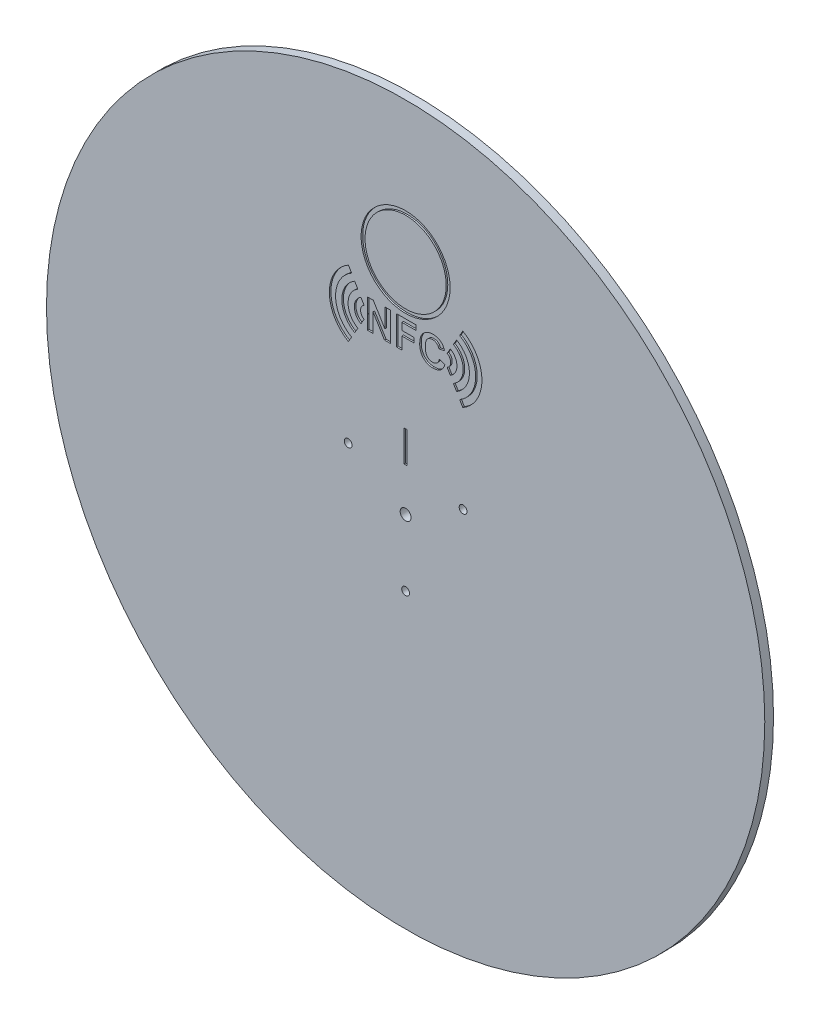
from build123d import *

# Parameters (mm, degrees)
SKETCH1_R           = 115
SKETCH1_R_2         = 12.6
SKETCH1_R_3         = 1.75
BOSS_EXTRUDE1_DEPTH = 1.2
SKETCH2_R           = 115
SKETCH2_R_2         = 1.75
BOSS_EXTRUDE2_DEPTH = 0.8
SKETCH3_R           = 14.25
SKETCH3_R_2         = 13
CUT_EXTRUDE1_DEPTH  = 0.5
BOSS_EXTRUDE3_START = 0.8
SKETCH4_R           = 115
SKETCH4_R_2         = 1.75
BOSS_EXTRUDE3_DEPTH = 0.8
SKETCH5_R           = 1.25
SKETCH5_W           = 1
SKETCH5_H           = 10
CUT_EXTRUDE2_DEPTH  = 2.8
SKETCH6_W           = 1
SKETCH6_H           = 10
BOSS_EXTRUDE4_DEPTH = 2.3


with BuildPart() as part:
    # Sketch1 → Boss-Extrude1 (new body)
    with BuildSketch(Plane.XY):
        Circle(SKETCH1_R)
        with Locations((0, 70)):
            Circle(SKETCH1_R_2, mode=Mode.SUBTRACT)
        Circle(SKETCH1_R_3, mode=Mode.SUBTRACT)
    extrude(amount=BOSS_EXTRUDE1_DEPTH)

    # Sketch2 → Boss-Extrude2 (add)
    with BuildSketch(Plane.XY.offset(1.2)):
        Circle(SKETCH2_R)
        Circle(SKETCH2_R_2, mode=Mode.SUBTRACT)
    extrude(amount=BOSS_EXTRUDE2_DEPTH)

    # Sketch3 → Cut-Extrude1 (cut)
    # profile 1 of 10: a face of its own
    with BuildSketch(Plane.XY.offset(2)):
        with BuildLine():
            Line((-14.304598289, 45.736382), (-13.304598289, 47.468432807))
            ThreePointArc((-13.304598289, 47.468432807), (-14.429598289, 49.416989966), (-13.304598289, 51.365547124))
            Line((-13.304598289, 51.365547124), (-14.304598289, 53.097597932))
            ThreePointArc((-14.304598289, 53.097597932), (-16.429598289, 49.416989966), (-14.304598289, 45.736382))
        make_face()
    # profile 2 of 10: a face of its own
    with BuildSketch(Plane.XY.offset(2)):
        Polygon((-12.179598289, 49.416989966), (-12.209391902, 49.365385915), (-12.209391902, 45), (-10.43132512, 45), (-10.43132512, 50.98245386), (-6.7751753, 45), (-4.860049204, 45), (-4.860049204, 54.245947266), (-6.638115986, 54.245947266), (-6.638115986, 48.167181455), (-10.351682546, 54.245947266), (-12.209391902, 54.245947266), (-12.209391902, 49.468594016), align=None)
    # profile 3 of 10: a face of its own
    with BuildSketch(Plane.XY.offset(2)):
        with BuildLine():
            Line((-16.304598289, 42.272280384), (-15.304598289, 44.004331192))
            ThreePointArc((-15.304598289, 44.004331192), (-18.429598289, 49.416989966), (-15.304598289, 54.829648739))
            Line((-15.304598289, 54.829648739), (-16.304598289, 56.561699547))
            ThreePointArc((-16.304598289, 56.561699547), (-20.429598289, 49.416989966), (-16.304598289, 42.272280384))
        make_face()
    # profile 4 of 10: a face of its own
    with BuildSketch(Plane.XY.offset(2)):
        with BuildLine():
            Line((-18.304598289, 38.808178769), (-17.304598289, 40.540229577))
            ThreePointArc((-17.304598289, 40.540229577), (-22.429598289, 49.416989966), (-17.304598289, 58.293750354))
            Line((-17.304598289, 58.293750354), (-18.304598289, 60.025801162))
            ThreePointArc((-18.304598289, 60.025801162), (-24.429598289, 49.416989966), (-18.304598289, 38.808178769))
        make_face()
    # profile 5 of 10: a face of its own
    with BuildSketch(Plane.XY.offset(2)):
        with BuildLine():
            ThreePointArc((13.304598289, 51.365547124), (14.429598289, 49.416989966), (13.304598289, 47.468432807))
            Line((13.304598289, 47.468432807), (14.304598289, 45.736382))
            ThreePointArc((14.304598289, 45.736382), (16.429598289, 49.416989966), (14.304598289, 53.097597932))
            Line((14.304598289, 53.097597932), (13.304598289, 51.365547124))
        make_face()
    # profile 6 of 10: a face of its own
    with BuildSketch(Plane.XY.offset(2)):
        with BuildLine():
            ThreePointArc((15.304598289, 54.829648739), (18.429598289, 49.416989966), (15.304598289, 44.004331192))
            Line((15.304598289, 44.004331192), (16.304598289, 42.272280384))
            ThreePointArc((16.304598289, 42.272280384), (20.429598289, 49.416989966), (16.304598289, 56.561699547))
            Line((16.304598289, 56.561699547), (15.304598289, 54.829648739))
        make_face()
    # profile 7 of 10: a face of its own
    with BuildSketch(Plane.XY.offset(2)):
        with BuildLine():
            ThreePointArc((17.304598289, 58.293750354), (22.429598289, 49.416989966), (17.304598289, 40.540229577))
            Line((17.304598289, 40.540229577), (18.304598289, 38.808178769))
            ThreePointArc((18.304598289, 38.808178769), (24.429598289, 49.416989966), (18.304598289, 60.025801162))
            Line((18.304598289, 60.025801162), (17.304598289, 58.293750354))
        make_face()
    # profile 8 of 10: a face of its own
    with BuildSketch(Plane.XY.offset(2)):
        Polygon((-2.963444636, 54.245947266), (-2.963444636, 45), (-1.185377855, 45), (-1.185377855, 48.91174692), (2.726369066, 48.91174692), (2.726369066, 50.452738131), (-1.185377855, 50.452738131), (-1.185377855, 52.704956055), (3.319057993, 52.704956055), (3.319057993, 54.245947266), align=None)
    # profile 9 of 10: a face of its own
    with BuildSketch(Plane.XY.offset(2)):
        with BuildLine():
            Line((12.565005258, 47.844906851), (10.786938477, 48.437595778))
            add(Edge.make_bspline(
                [(8.649554033, 46.540991211), (8.774457906, 46.542804078), (8.960902987, 46.552124821), (9.200761468, 46.603342992), (9.371697205, 46.653314203), (9.536735909, 46.716051803), (9.693353441, 46.796521205), (9.844632955, 46.889011376), (9.987435142, 46.997402051), (10.123671935, 47.119091548), (10.24792915, 47.259733892), (10.363183369, 47.415951417), (10.467995906, 47.588781763), (10.565774579, 47.776770817), (10.680063587, 48.058750047), (10.75051939, 48.282015418), (10.786938477, 48.437595778)],
                knots=[0, 0, 0, 0, 0.12046088, 0.178740623, 0.235724111, 0.291792154, 0.348405626, 0.404978529, 0.462271107, 0.520759571, 0.580529381, 0.642578218, 0.707405436, 0.774920301, 0.846330275, 1, 1, 1, 1], degree=3))
            add(Edge.make_bspline(
                [(6.282502629, 49.737807112), (6.285322977, 49.470306981), (6.297610529, 49.082539498), (6.369602887, 48.589695915), (6.440666935, 48.264864831), (6.532669328, 47.970595781), (6.645226739, 47.70740396), (6.779038197, 47.474979778), (6.933893175, 47.273478116), (7.10587723, 47.100389393), (7.290332212, 46.951570368), (7.486169728, 46.82433845), (7.694568912, 46.719631559), (7.916319835, 46.640528882), (8.233117363, 46.562073655), (8.481308806, 46.539908407), (8.649554033, 46.540991211)],
                knots=[0, 0, 0, 0, 0.177656206, 0.256732639, 0.330177257, 0.398062973, 0.460994883, 0.519731382, 0.575527448, 0.629114465, 0.681254032, 0.732497652, 0.783792002, 0.835623311, 0.888378762, 1, 1, 1, 1], degree=3))
            add(Edge.make_bspline(
                [(8.66066695, 52.82349384), (8.491465901, 52.826075047), (8.242559674, 52.799846285), (7.922640611, 52.727085572), (7.699736188, 52.646106315), (7.49074803, 52.54236084), (7.293294797, 52.416290582), (7.108461861, 52.268387934), (6.93618627, 52.096913588), (6.781592493, 51.898763678), (6.645681991, 51.673529995), (6.532934048, 51.418655469), (6.441392441, 51.136639915), (6.369372519, 50.826818405), (6.298040133, 50.35919413), (6.285308784, 49.991144174), (6.282502629, 49.737807112)],
                knots=[0, 0, 0, 0, 0.114442147, 0.169048205, 0.221995274, 0.274768432, 0.326888881, 0.380476958, 0.434920839, 0.491256742, 0.550390474, 0.612762372, 0.679720015, 0.751074463, 0.828128845, 1, 1, 1, 1], degree=3))
            add(Edge.make_bspline(
                [(10.668400691, 51.282502629), (10.641238914, 51.398054972), (10.587850378, 51.565642196), (10.494156792, 51.777398501), (10.408574753, 51.921779276), (10.317598271, 52.060296222), (10.209906332, 52.186819303), (10.09235562, 52.304658865), (9.964105005, 52.412593655), (9.82668186, 52.508441667), (9.682732574, 52.594604872), (9.529640338, 52.664934387), (9.369443041, 52.721855687), (9.202773529, 52.769483738), (8.965989688, 52.809862605), (8.784209014, 52.826424315), (8.66066695, 52.82349384)],
                knots=[0, 0, 0, 0, 0.129415079, 0.191523435, 0.252186483, 0.312349991, 0.372123769, 0.433096486, 0.493819352, 0.554747395, 0.615749876, 0.676633212, 0.738216912, 0.801141922, 0.865493176, 1, 1, 1, 1], degree=3))
            Line((10.668400691, 51.282502629), (12.446467473, 51.638115986))
            add(Edge.make_bspline(
                [(11.51113026, 53.353209569), (11.618919371, 53.252134624), (11.765446177, 53.081421549), (11.939181695, 52.831726814), (12.062269606, 52.625570238), (12.171970389, 52.4010392), (12.311226739, 52.074446139), (12.396954988, 51.816309851), (12.446467473, 51.638115986)],
                knots=[0, 0, 0, 0, 0.223922581, 0.340367194, 0.461366928, 0.58791332, 0.71930972, 1, 1, 1, 1], degree=3))
            add(Edge.make_bspline(
                [(8.784761194, 54.364485051), (9.05213035, 54.36170592), (9.447480124, 54.337725331), (9.952714034, 54.227961891), (10.305824473, 54.11948993), (10.638318496, 53.976085526), (11.056637945, 53.742604246), (11.338718425, 53.518758054), (11.51113026, 53.353209569)],
                knots=[0, 0, 0, 0, 0.269221899, 0.396222126, 0.519140292, 0.640111566, 0.759624432, 1, 1, 1, 1], degree=3))
            add(Edge.make_bspline(
                [(4.504435847, 49.602599951), (4.503806189, 49.95935967), (4.53809244, 50.480966902), (4.660090028, 51.150009144), (4.790227099, 51.606032572), (4.954122369, 52.032375199), (5.160126736, 52.424803313), (5.398535284, 52.788549361), (5.675745533, 53.116946458), (5.983655723, 53.408518035), (6.31361956, 53.666348484), (6.66871472, 53.882641187), (7.047001045, 54.059546034), (7.448974215, 54.196322464), (8.026435231, 54.330802367), (8.478762466, 54.361874395), (8.784761194, 54.364485051)],
                knots=[0, 0, 0, 0, 0.147853475, 0.216062561, 0.281513739, 0.344147287, 0.405039848, 0.464871931, 0.524079073, 0.582724997, 0.640361728, 0.697328761, 0.754684166, 0.813113061, 0.873014604, 1, 1, 1, 1], degree=3))
            add(Edge.make_bspline(
                [(8.721787996, 45), (8.426367251, 44.997988178), (7.990266773, 45.035933953), (7.432039385, 45.166823587), (7.03995053, 45.29954369), (6.670218657, 45.47557439), (6.319473407, 45.687433116), (5.990266678, 45.939486093), (5.683753354, 46.22746781), (5.405279268, 46.5491846), (5.164468655, 46.902896762), (4.958714021, 47.283621418), (4.792375452, 47.693174913), (4.662454179, 48.131132452), (4.537348729, 48.767470915), (4.504184947, 49.264405834), (4.504435847, 49.602599951)],
                knots=[0, 0, 0, 0, 0.126018891, 0.185824822, 0.244304364, 0.302279211, 0.360195978, 0.418835489, 0.47884239, 0.539358251, 0.600002403, 0.661054814, 0.723669356, 0.788261327, 0.855679185, 1, 1, 1, 1], degree=3))
            add(Edge.make_bspline(
                [(12.565005258, 47.844906851), (12.497380357, 47.615920501), (12.382150303, 47.28238474), (12.179541249, 46.869560595), (12.017716763, 46.586721298), (11.832453107, 46.331624647), (11.634211253, 46.095805011), (11.41707355, 45.884234212), (11.182117383, 45.696459001), (10.931602763, 45.530405863), (10.662620144, 45.390024222), (10.379183478, 45.269124387), (10.078419057, 45.171142401), (9.76232112, 45.0927817), (9.309084503, 45.021757353), (8.959586718, 44.99891792), (8.721787996, 45)],
                knots=[0, 0, 0, 0, 0.137894803, 0.202902916, 0.265167572, 0.325674736, 0.3845661, 0.442763708, 0.500294498, 0.557901352, 0.615910004, 0.675133413, 0.735519841, 0.79825159, 0.862854286, 1, 1, 1, 1], degree=3))
        make_face()
    # profile 10 of 10: a face of its own
    with BuildSketch(Plane.XY.offset(2)):
        with Locations((0, 70)):
            Circle(SKETCH3_R)
        with Locations((0, 70)):
            Circle(SKETCH3_R_2, mode=Mode.SUBTRACT)
    extrude(amount=-CUT_EXTRUDE1_DEPTH, mode=Mode.SUBTRACT)

    # Sketch4 → Boss-Extrude3 (add)
    with BuildSketch(Plane(origin=(0, 0, 0), x_dir=(-1, 0, 0), z_dir=(0, 0, -1)).offset(BOSS_EXTRUDE3_START)):
        Circle(SKETCH4_R)
        Circle(SKETCH4_R_2, mode=Mode.SUBTRACT)
    extrude(amount=-BOSS_EXTRUDE3_DEPTH)

    # Sketch5 → Cut-Extrude2 (cut)
    with BuildSketch(Plane.XY.offset(2)):
        with Locations((0, -21.25)):
            Circle(SKETCH5_R)
        with Locations((-18.40303983, 10.625)):
            Circle(SKETCH5_R)
        with Locations((18.40303983, 10.625)):
            Circle(SKETCH5_R)
        with Locations((0, 18.75)):
            Rectangle(SKETCH5_W, SKETCH5_H)
    extrude(amount=-CUT_EXTRUDE2_DEPTH, mode=Mode.SUBTRACT)

    # Sketch6 → Boss-Extrude4 (add)
    with BuildSketch(Plane(origin=(0, 0, -0.8), x_dir=(-1, 0, 0), z_dir=(0, 0, -1))):
        with Locations((0, 18.75)):
            Rectangle(SKETCH6_W, SKETCH6_H)
    extrude(amount=-BOSS_EXTRUDE4_DEPTH)


solid = part.part
